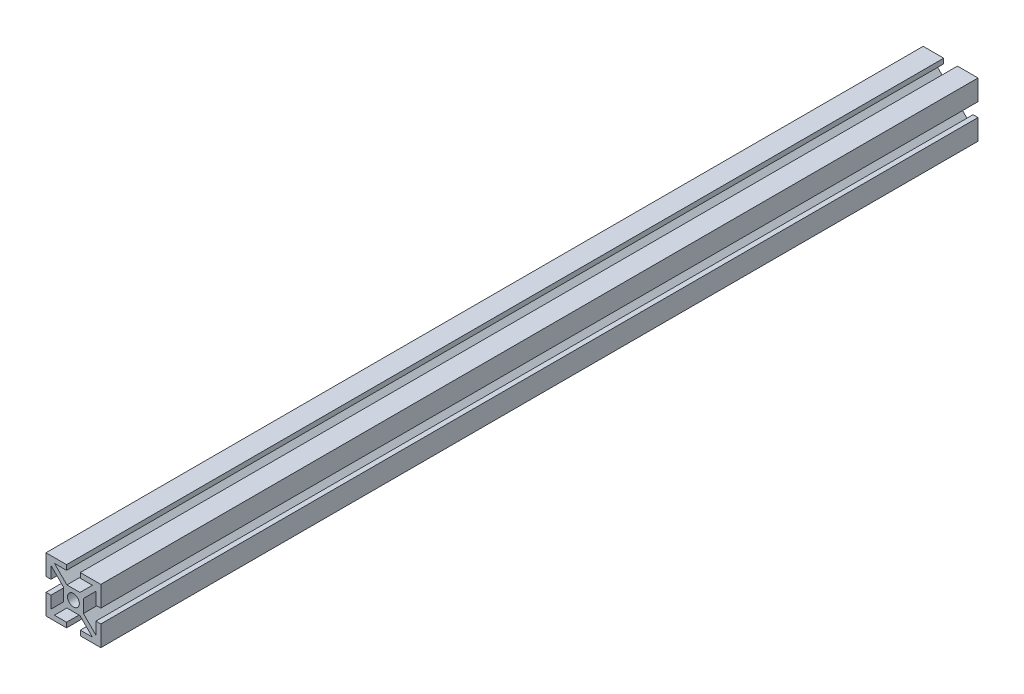
from build123d import *

# Parameters (mm, degrees)
ESQUISSE1_R        = 2.15
BOSS_EXTRU_1_DEPTH = 320


with BuildPart() as part:
    # Esquisse1 → Boss.-Extru.1 (new body)
    with BuildSketch(Plane.XY):
        Polygon((20, 12.5), (18.2, 12.5), (18.2, 16.927207794), (13.65, 12.377207794), (13.65, 10), (13.65, 7.622792206), (18.2, 3.072792206), (18.2, 7.5), (20, 7.5), (20, 0), (12.5, 0), (12.5, 1.8), (16.927207794, 1.8), (12.377207794, 6.35), (10, 6.35), (7.622792206, 6.35), (3.072792206, 1.8), (7.5, 1.8), (7.5, 0), (0, 0), (0, 7.5), (1.8, 7.5), (1.8, 3.072792206), (6.35, 7.622792206), (6.35, 10), (6.35, 12.377207794), (1.8, 16.927207794), (1.8, 12.5), (0, 12.5), (0, 20), (7.5, 20), (7.5, 18.2), (3.072792206, 18.2), (7.622792206, 13.65), (10, 13.65), (12.377207794, 13.65), (16.927207794, 18.2), (12.5, 18.2), (12.5, 20), (20, 20), align=None)
        with Locations((10, 10)):
            Circle(ESQUISSE1_R, mode=Mode.SUBTRACT)
    extrude(amount=BOSS_EXTRU_1_DEPTH)


solid = part.part
